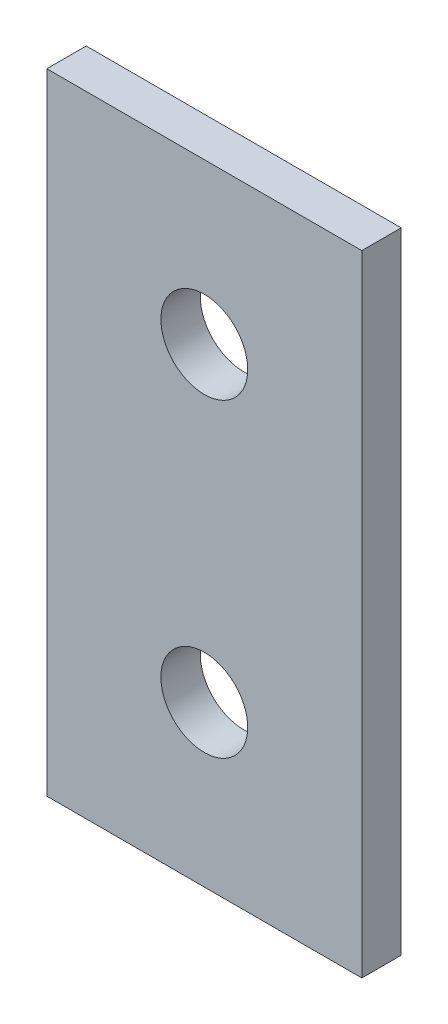
from build123d import *

# Parameters (mm, degrees)
SKETCH1_W           = 25.4
SKETCH1_H           = 50.8
SKETCH1_R           = 3.5
BOSS_EXTRUDE1_DEPTH = 3.175


with BuildPart() as part:
    # Sketch1 → Boss-Extrude1 (new body)
    with BuildSketch(Plane.XY):
        Rectangle(SKETCH1_W, SKETCH1_H)
        with Locations((0, 12.5)):
            Circle(SKETCH1_R, mode=Mode.SUBTRACT)
        with Locations(Location((0, -12.5, 0), (0, 0, 180))):
            Circle(SKETCH1_R, mode=Mode.SUBTRACT)
    extrude(amount=BOSS_EXTRUDE1_DEPTH)


solid = part.part
